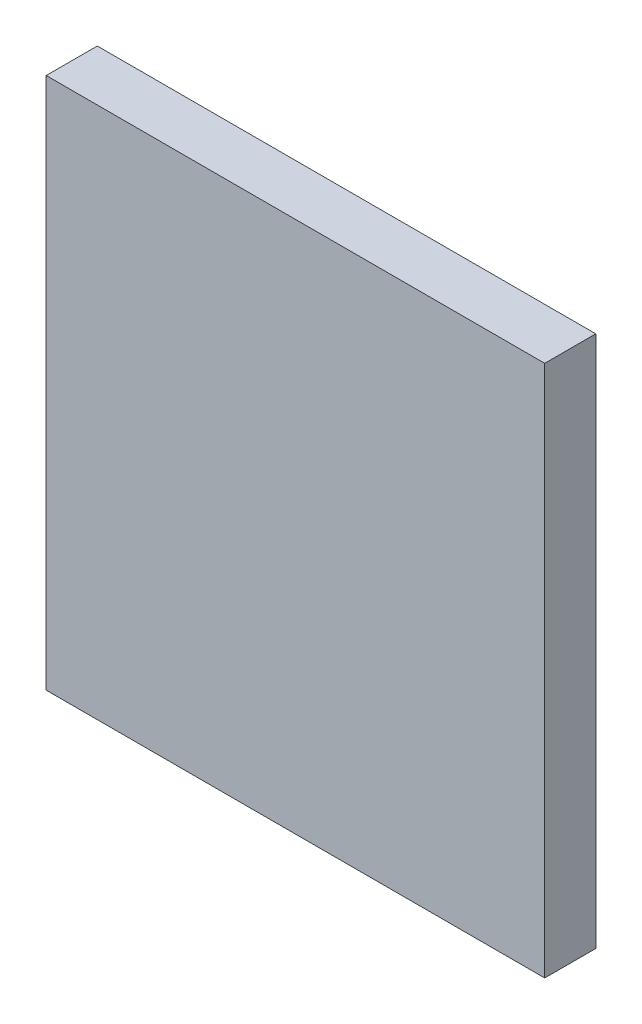
from build123d import *

# Parameters (mm, degrees)
SKETCH1_W           = 65.111036142
SKETCH1_H           = 104.231247157
SKETCH1_W_2         = 12.511082186
SKETCH1_W_3         = 10.525971643
SKETCH1_W_4         = 9.456374357
BOSS_EXTRUDE1_DEPTH = 10


with BuildPart() as part:
    # Sketch1 → Boss-Extrude1 (new body)
    with BuildSketch(Plane.XY):
        with Locations((136.652791902, -0.803839953)):
            Rectangle(SKETCH1_W, SKETCH1_H)
        with Locations((97.841732738, -0.803839953)):
            Rectangle(SKETCH1_W_2, SKETCH1_H)
        with Locations((183.927670152, -0.803839953)):
            Rectangle(SKETCH1_W_3, SKETCH1_H)
        with Locations((173.936497152, -0.803839953)):
            Rectangle(SKETCH1_W_4, SKETCH1_H)
    extrude(amount=BOSS_EXTRUDE1_DEPTH)


solid = part.part
